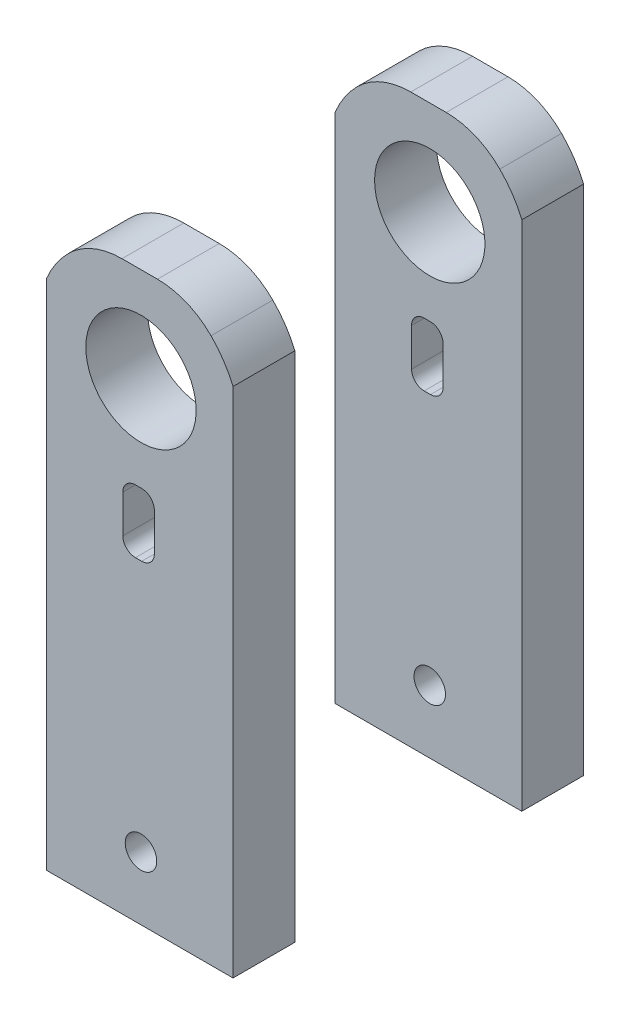
from build123d import *

# Parameters (mm, degrees)
SKETCH2_W           = 37.592
SKETCH2_H           = 12.446
BOSS_EXTRUDE1_DEPTH = 114.3
SKETCH3_R           = 3.175
CUT_EXTRUDE1_DEPTH  = 12.7
SKETCH4_R           = 11.1125
CUT_EXTRUDE2_DEPTH  = 12.7
SKETCH5_W           = 6.35
SKETCH5_H           = 12.7
CUT_EXTRUDE3_DEPTH  = 12.7
FILLET2_R           = 2.54
FILLET3_R           = 2.54
CUT_EXTRUDE4_START  = -70.612
CUT_EXTRUDE4_DEPTH  = 70.612
FILLET4_R           = 15.24
FILLET5_R           = 15.24


with BuildPart() as part:
    # Sketch2 → Boss-Extrude1 (new body)
    with BuildSketch(Plane(origin=(0, 0, 0), x_dir=(1, 0, 0), z_dir=(0, 1, 0))):
        with Locations((-0.254, 0)):
            Rectangle(SKETCH2_W, SKETCH2_H)
    extrude(amount=BOSS_EXTRUDE1_DEPTH)

    # Sketch3 → Cut-Extrude1 (cut)
    with BuildSketch(Plane(origin=(0, 0, -6.223), x_dir=(-1, 0, 0), z_dir=(0, 0, -1))):
        with Locations((0, 12.7)):
            Circle(SKETCH3_R)
    extrude(amount=-CUT_EXTRUDE1_DEPTH, mode=Mode.SUBTRACT)

    # Sketch4 → Cut-Extrude2 (cut)
    with BuildSketch(Plane(origin=(0, 0, -6.223), x_dir=(-1, 0, 0), z_dir=(0, 0, -1))):
        with Locations((0, 95.25)):
            Circle(SKETCH4_R)
    extrude(amount=-CUT_EXTRUDE2_DEPTH, mode=Mode.SUBTRACT)

    # Sketch5 → Cut-Extrude3 (cut)
    with BuildSketch(Plane(origin=(0, 0, -6.223), x_dir=(-1, 0, 0), z_dir=(0, 0, -1))):
        with Locations((0.486934661, 69.85)):
            Rectangle(SKETCH5_W, SKETCH5_H)
    extrude(amount=-CUT_EXTRUDE3_DEPTH, mode=Mode.SUBTRACT)


with BuildPart() as body_2:
    # Mirror7: mirrored copy
    add(part.part.mirror(Plane.XY.offset(29.083)))

    # Fillet3
    fillet3_edges = [body_2.edges().sort_by_distance(p)[0] for p in [
        (2.688065339, 76.2, 58.166),
        (-3.661934661, 76.2, 58.166),
        (-3.661934661, 63.5, 58.166),
        (2.688065339, 63.5, 58.166),
    ]]
    fillet(fillet3_edges, radius=FILLET3_R)


with BuildPart() as part_1:
    add(part.part)

    # Fillet2
    fillet2_edges = [part_1.edges().sort_by_distance(p)[0] for p in [
        (2.688065339, 76.2, 0),
        (-3.661934661, 76.2, 0),
        (-3.661934661, 63.5, 0),
        (2.688065339, 63.5, 0),
    ]]
    fillet(fillet2_edges, radius=FILLET2_R)


with BuildPart() as cut_extrude4_tool:
    # Sketch6 → Cut-Extrude4 (new body)
    with BuildSketch(Plane.XY.offset(64.389).offset(CUT_EXTRUDE4_START)):
        with BuildLine():
            Line((-19.05, 114.3), (-19.05, 103.1875))
            ThreePointArc((-19.05, 103.1875), (-14.592916197, 109.842916197), (-7.9375, 114.3))
            Line((-7.9375, 114.3), (-19.05, 114.3))
        make_face()
        with BuildLine():
            Line((18.542, 114.3), (7.4295, 114.3))
            ThreePointArc((7.4295, 114.3), (14.084916197, 109.842916197), (18.542, 103.1875))
            Line((18.542, 103.1875), (18.542, 114.3))
        make_face()
    extrude(amount=CUT_EXTRUDE4_DEPTH)


with BuildPart() as part_2:
    add(part_1.part)

    # Cut-Extrude4: cut by cut_extrude4_tool
    add(cut_extrude4_tool.part, mode=Mode.SUBTRACT)

    # Fillet4
    fillet4_edges = [part_2.edges().sort_by_distance(p)[0] for p in [
        (-7.9375, 114.3, 0),
        (7.4295, 114.3, 0),
    ]]
    fillet(fillet4_edges, radius=FILLET4_R)


with BuildPart() as body_2_1:
    add(body_2.part)

    # Cut-Extrude4: cut by cut_extrude4_tool
    add(cut_extrude4_tool.part, mode=Mode.SUBTRACT)

    # Fillet5
    fillet5_edges = [body_2_1.edges().sort_by_distance(p)[0] for p in [
        (7.4295, 114.3, 58.166),
        (-7.9375, 114.3, 58.166),
    ]]
    fillet(fillet5_edges, radius=FILLET5_R)


solid = Compound([part_2.part, body_2_1.part])
